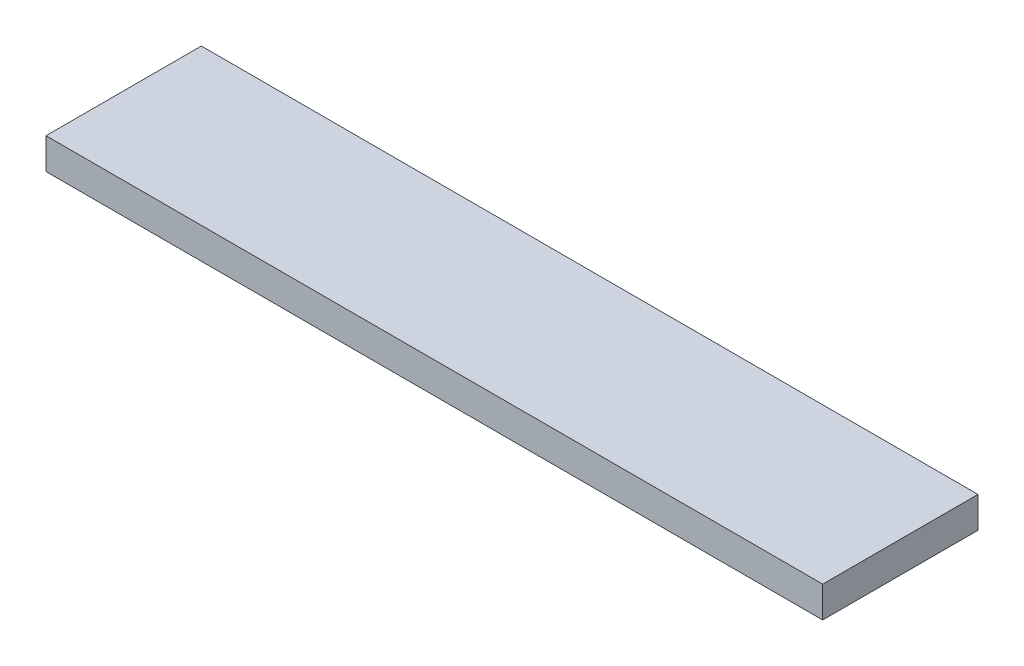
from build123d import *

# Parameters (mm, degrees)
SKETCH1_W           = 150
SKETCH1_H           = 30
BOSS_EXTRUDE1_DEPTH = 6


with BuildPart() as part:
    # Sketch1 → Boss-Extrude1 (new body)
    with BuildSketch(Plane(origin=(0, 0, 0), x_dir=(1, 0, 0), z_dir=(0, 1, 0))):
        Rectangle(SKETCH1_W, SKETCH1_H)
    extrude(amount=BOSS_EXTRUDE1_DEPTH)


solid = part.part
